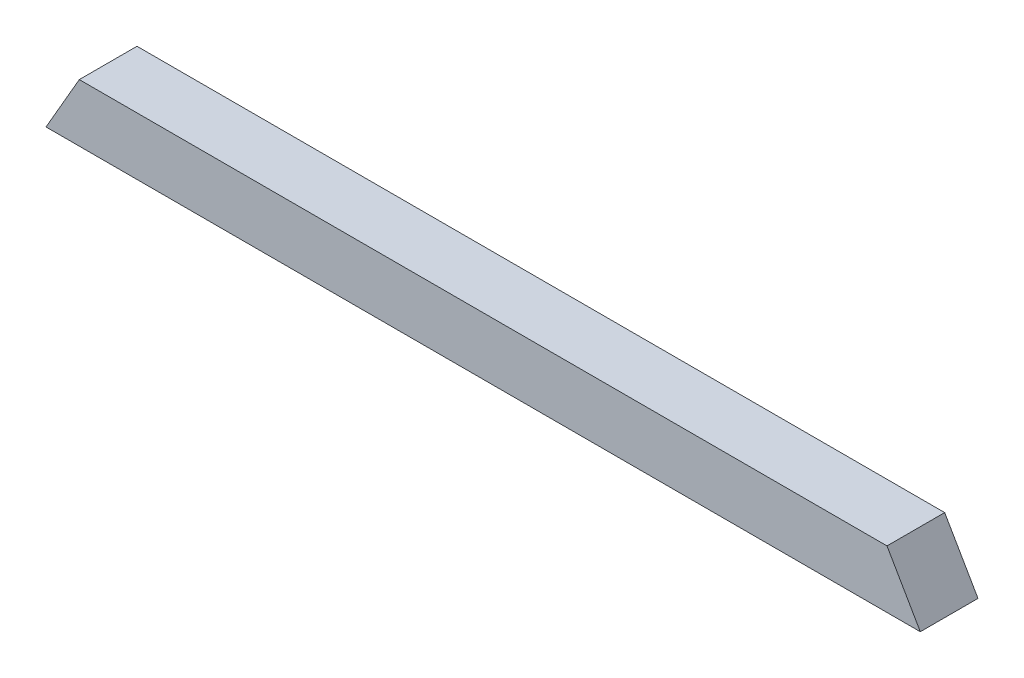
from build123d import *

# Parameters (mm, degrees)
BOSS_EXTRUDE2_DEPTH = 20


with BuildPart() as part:
    # Sketch1 → Boss-Extrude2 (new body)
    with BuildSketch(Plane.XY):
        Polygon((-140, 0), (140, 0), (151.547005384, -20), (-151.547005384, -20), align=None)
    extrude(amount=BOSS_EXTRUDE2_DEPTH)


solid = part.part
